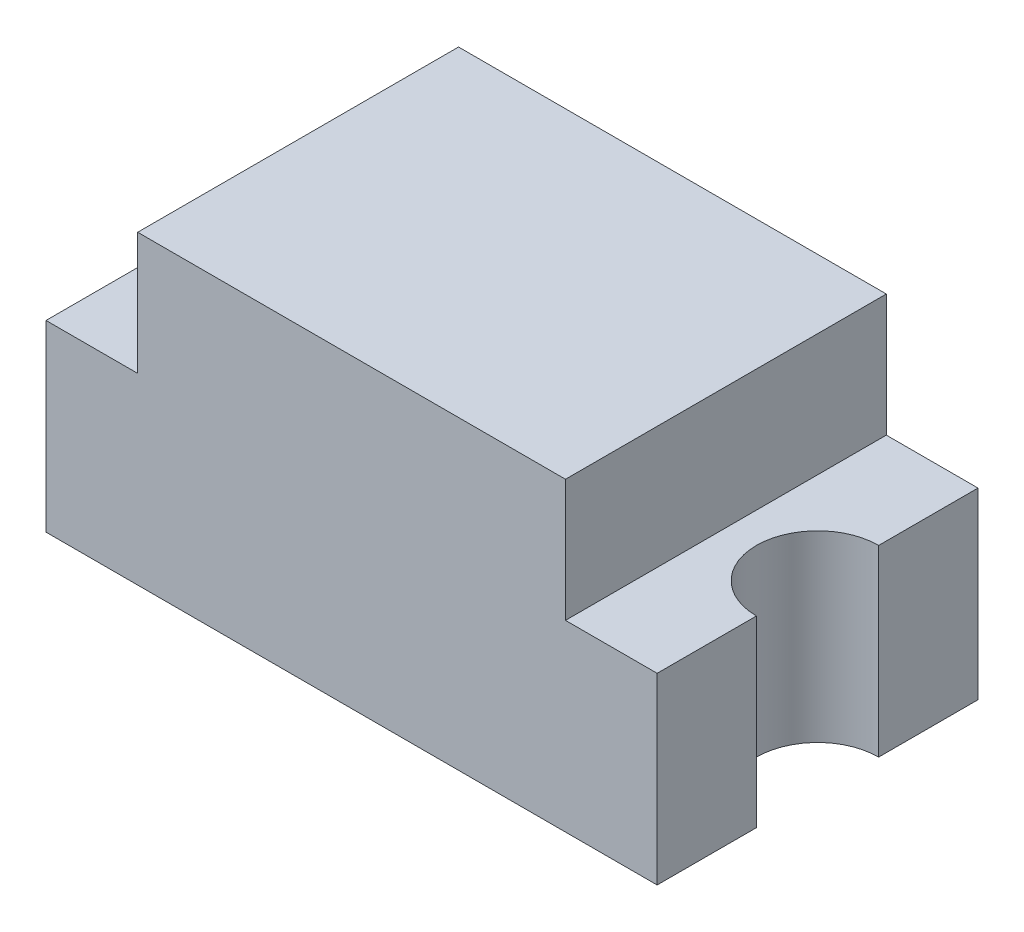
from build123d import *

# Parameters (mm, degrees)
BOSS_EXTRUDE1_DEPTH = 0.6
SKETCH4_W           = 1.4
SKETCH4_H           = 1.05
BOSS_EXTRUDE3_DEPTH = 0.4


with BuildPart() as part:
    # Sketch1 → Boss-Extrude1 (new body)
    with BuildSketch(Plane(origin=(0, 0, 0), x_dir=(1, 0, 0), z_dir=(0, 1, 0))):
        with BuildLine():
            Line((-1, -0.2), (-1, -0.525))
            Line((-1, -0.525), (1, -0.525))
            Line((1, -0.525), (1, -0.2))
            ThreePointArc((1, -0.2), (0.8, 0), (1, 0.2))
            Line((1, 0.2), (1, 0.525))
            Line((1, 0.525), (-1, 0.525))
            Line((-1, 0.525), (-1, 0.2))
            ThreePointArc((-1, 0.2), (-0.858578644, 0.141421356), (-0.8, 0))
            ThreePointArc((-0.8, 0), (-0.858578644, -0.141421356), (-1, -0.2))
        make_face()
    extrude(amount=BOSS_EXTRUDE1_DEPTH)

    # Sketch4 → Boss-Extrude3 (add)
    with BuildSketch(Plane(origin=(0, 0.6, 0), x_dir=(1, 0, 0), z_dir=(0, 1, 0))):
        Rectangle(SKETCH4_W, SKETCH4_H)
    extrude(amount=BOSS_EXTRUDE3_DEPTH)


solid = part.part
